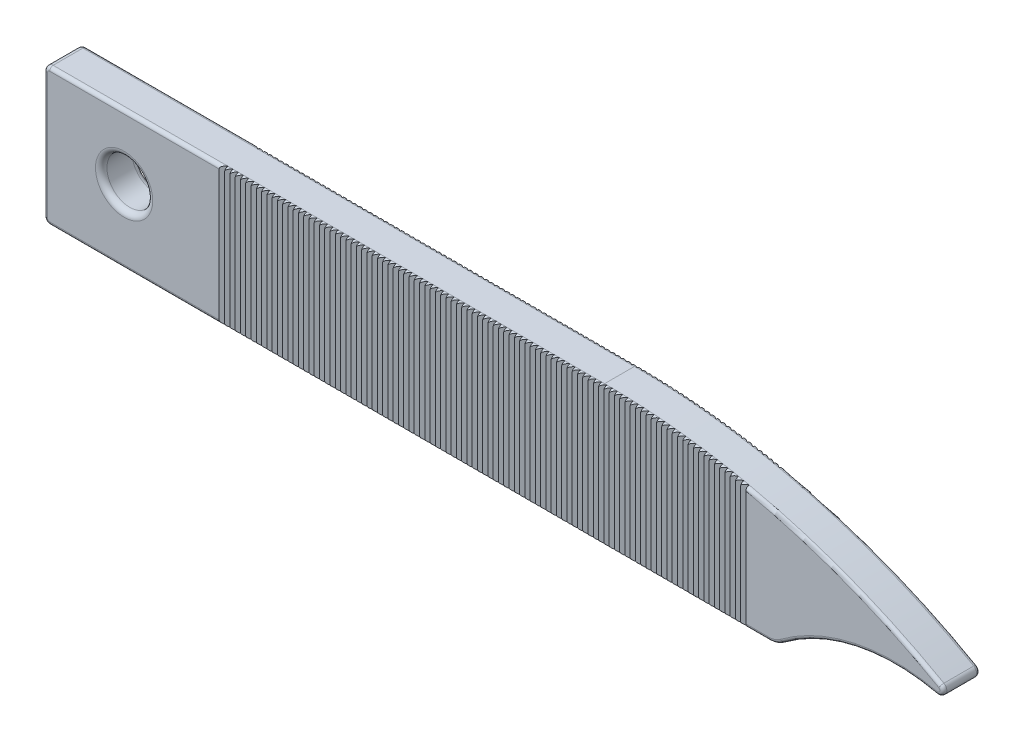
from build123d import *

# Parameters (mm, degrees)
BOSS_EXTRUDE1_DEPTH = 1.6
FILLET1_R           = 1
FILLET2_R           = 0.25
FILLET3_R           = 0.25
FILLET4_R           = 0.15
SKETCH2_R           = 1
CUT_EXTRUDE1_DEPTH  = 40.776076254
FILLET5_R           = 0.25
CUT_EXTRUDE2_DEPTH  = 14.6
LPATTERN1_COUNT     = 100
LPATTERN1_PITCH     = 0.23


with BuildPart() as part:
    # Sketch1 → Boss-Extrude1 (new body)
    with BuildSketch(Plane.XY):
        with BuildLine():
            Line((0, 0), (0, 6))
            Line((0, 6), (24.338247539, 6))
            ThreePointArc((24.338247539, 6), (33.625335349, 4.526303651), (42, 0.25))
            ThreePointArc((42, 0.25), (36.957569818, 1.822207278), (32, 0))
            Line((32, 0), (0, 0))
        make_face()
    extrude(amount=BOSS_EXTRUDE1_DEPTH)

    # Fillet1
    fillet1_edges = [part.edges().sort_by_distance(p)[0] for p in [
        (32, 0, 0.8),
    ]]
    fillet(fillet1_edges, radius=FILLET1_R)

    # Fillet2
    fillet2_edges = [part.edges().sort_by_distance(p)[0] for p in [
        (42, 0.25, 0.8),
    ]]
    fillet(fillet2_edges, radius=FILLET2_R)

    # Fillet3
    fillet3_edges = [part.edges().sort_by_distance(p)[0] for p in [
        (0, 0, 0.8),
        (0, 6, 0.8),
    ]]
    fillet(fillet3_edges, radius=FILLET3_R)

    # Fillet4
    fillet4_edges = [part.edges().sort_by_distance(p)[0] for p in [
        (12.294123769, 6, 1.6),
        (35.463109854, 1.647020161, 0),
        (35.463109854, 1.647020161, 1.6),
        (31.972534899, 0.050788773, 0),
        (31.972534899, 0.050788773, 1.6),
        (32.004622455, 5.003908282, 0),
        (32.004622455, 5.003908282, 1.6),
        (39.271445502, 1.774004303, 0),
        (39.271445502, 1.774004303, 1.6),
        (15.953947674, 0, 0),
        (15.953947674, 0, 1.6),
        (0, 3, 0),
        (0.073223305, 5.926776695, 0),
        (0.073223305, 0.073223305, 0),
        (0, 3, 1.6),
        (0.073223305, 5.926776695, 1.6),
        (0.073223305, 0.073223305, 1.6),
        (12.294123769, 6, 0),
    ]]
    fillet(fillet4_edges, radius=FILLET4_R)

    # Sketch2 → Cut-Extrude1 (cut, through all)
    with BuildSketch(Plane.XY.offset(1.6)):
        with Locations((3.5, 3.2)):
            Circle(SKETCH2_R)
    extrude(amount=-CUT_EXTRUDE1_DEPTH, mode=Mode.SUBTRACT)

    # Fillet5
    fillet5_edges = [part.edges().sort_by_distance(p)[0] for p in [
        (2.5, 3.2, 0),
        (2.5, 3.2, 1.6),
    ]]
    fillet(fillet5_edges, radius=FILLET5_R)

    # Sketch3 → Cut-Extrude2 (cut)
    with BuildSketch(Plane.XZ):
        Polygon((30.407895348, 1.60688118), (30.657895348, 1.45), (30.657895348, 1.60688118), align=None)
        Polygon((30.657895348, 0.15), (30.657895348, -0.00688118), (30.407895348, -0.00688118), align=None)
    cut_extrude2 = extrude(amount=-CUT_EXTRUDE2_DEPTH, mode=Mode.SUBTRACT)

    # LPattern1: Cut-Extrude2 ×100
    with Locations(*[(-i * LPATTERN1_PITCH, 0, 0) for i in range(1, LPATTERN1_COUNT)]):
        add(cut_extrude2, mode=Mode.SUBTRACT)


solid = part.part
